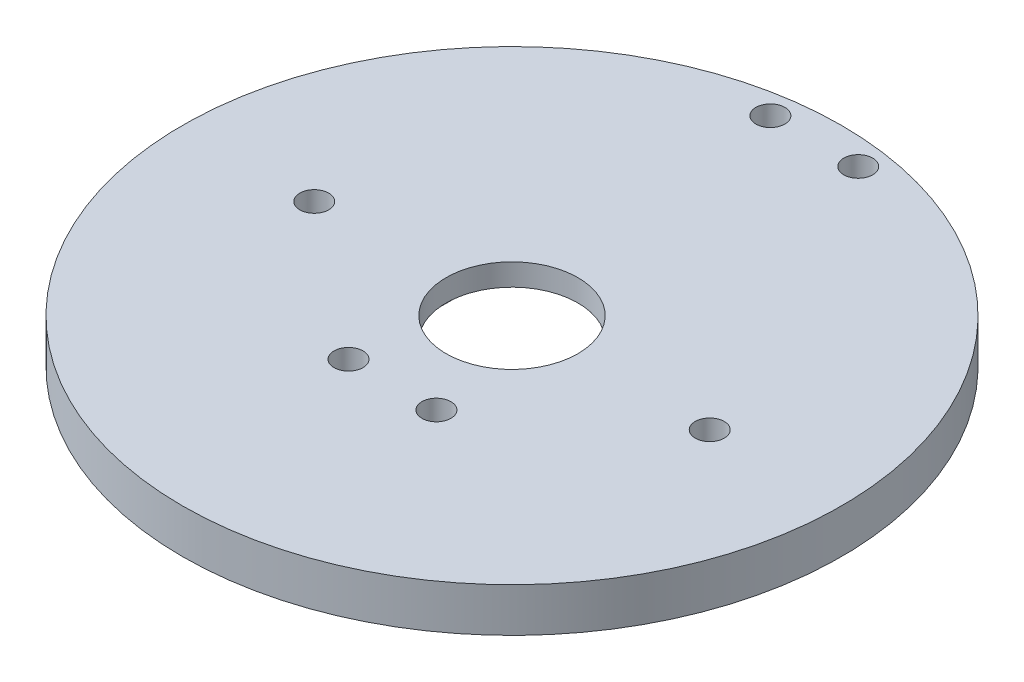
from build123d import *

# Parameters (mm, degrees)
ESQUISSE1_R             = 37.5
EXTRUSION1_DEPTH        = 5
ENL_V_MAT_EXTRU_2_DEPTH = 2.5
ESQUISSE7_R             = 7.5
ENL_V_MAT_EXTRU_3_DEPTH = 54.091901454
TROU_TARAUD_M4X0_71_D   = 3.3


with BuildPart() as part:
    # Esquisse1 → Extrusion1 (new body)
    with BuildSketch(Plane(origin=(0, 0, 0), x_dir=(1, 0, 0), z_dir=(0, 1, 0))):
        with Locations(Location((0, 0, 0), (0, 0, 270))):
            Circle(ESQUISSE1_R)
    extrude(amount=-EXTRUSION1_DEPTH)

    # Esquisse6 → Enlèv. mat.-Extru.2 (cut)
    with BuildSketch(Plane.XZ.offset(5)):
        with BuildLine():
            Line((-9.95, 1), (-9.95, -21.8))
            ThreePointArc((-9.95, -21.8), (-7.313961031, -28.163961031), (-0.95, -30.8))
            Line((-0.95, -30.8), (0.95, -30.8))
            ThreePointArc((0.95, -30.8), (7.313961031, -28.163961031), (9.95, -21.8))
            Line((9.95, -21.8), (9.95, 1))
            ThreePointArc((9.95, 1), (7.313961031, 7.363961031), (0.95, 10))
            Line((0.95, 10), (-0.95, 10))
            ThreePointArc((-0.95, 10), (-7.313961031, 7.363961031), (-9.95, 1))
        make_face()
    extrude(amount=-ENL_V_MAT_EXTRU_2_DEPTH, mode=Mode.SUBTRACT)

    # Esquisse7 → Enlèv. mat.-Extru.3 (cut, through all)
    with BuildSketch(Plane.XZ.offset(2.5)):
        Circle(ESQUISSE7_R)
    extrude(amount=-ENL_V_MAT_EXTRU_3_DEPTH, mode=Mode.SUBTRACT)

    # Trou taraudé M4x0.71 (through all)
    with Locations(Plane.XZ.offset(5)):
        with Locations((-5, -34.4), (5, -34.4), (-5, 13.6), (5, 13.6), (22.5, 0), (-22.5, 0)):
            Hole(TROU_TARAUD_M4X0_71_D / 2)


solid = part.part
